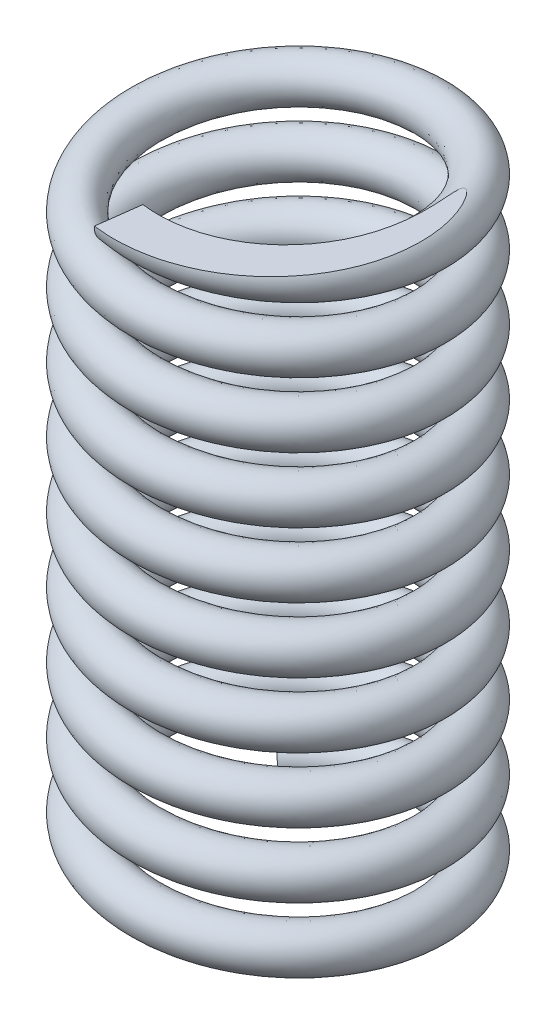
from build123d import *

# Parameters (mm, degrees)
SWEEP_1_PITCH       = 48
SWEEP_1_HEIGHT      = 463
SWEEP_1_RADIUS      = 105
SWEEP_1_START_ANGLE = -135
SKETCH_3_R          = 16
SKETCH_5_W          = 239.809535385
SKETCH_5_H          = 36.64178906
CUT_EXTRUDE_1_DEPTH = 509.609248411
SKETCH_7_W          = 266.184957527
SKETCH_7_H          = 60.378539146
CUT_EXTRUDE_2_DEPTH = 590.119751344


with BuildPart() as part:
    # 扫描1: sweep along a helix
    with BuildLine() as sweep_1_path:
        add(Helix(SWEEP_1_PITCH, SWEEP_1_HEIGHT, SWEEP_1_RADIUS, center=(0, 0, 0), direction=(0, 1, 0), lefthand=True, mode=Mode.PRIVATE).rotate(Axis((0, 0, 0), (0, 1, 0)), SWEEP_1_START_ANGLE))
    # 草图3 → 扫描1 (sweep)
    with BuildSketch(Plane(origin=(-74.246212025, 0, -74.246212025), x_dir=(-0.7089660221585455, 0.07218363850800827, -0.701538809871866), z_dir=(0.7052426386887628, 0.07256473765270713, -0.7052426386887742))):
        with Locations((-0.051062735, 0.031535881)):
            Circle(SKETCH_3_R)
    sweep(path=sweep_1_path.line, is_frenet=True)

    # 草图5 → 切除-拉伸1 (cut, through all)
    with BuildSketch(Plane.XY):
        with Locations((9.833385173, -18.32089453)):
            Rectangle(SKETCH_5_W, SKETCH_5_H)
    extrude(amount=-CUT_EXTRUDE_1_DEPTH, mode=Mode.SUBTRACT)

    # 草图7 → 切除-拉伸2 (cut, through all)
    with BuildSketch(Plane.XY.offset(200)):
        with Locations((1.554774811, 493.189269573)):
            Rectangle(SKETCH_7_W, SKETCH_7_H)
    extrude(amount=-CUT_EXTRUDE_2_DEPTH, mode=Mode.SUBTRACT)


solid = part.part
